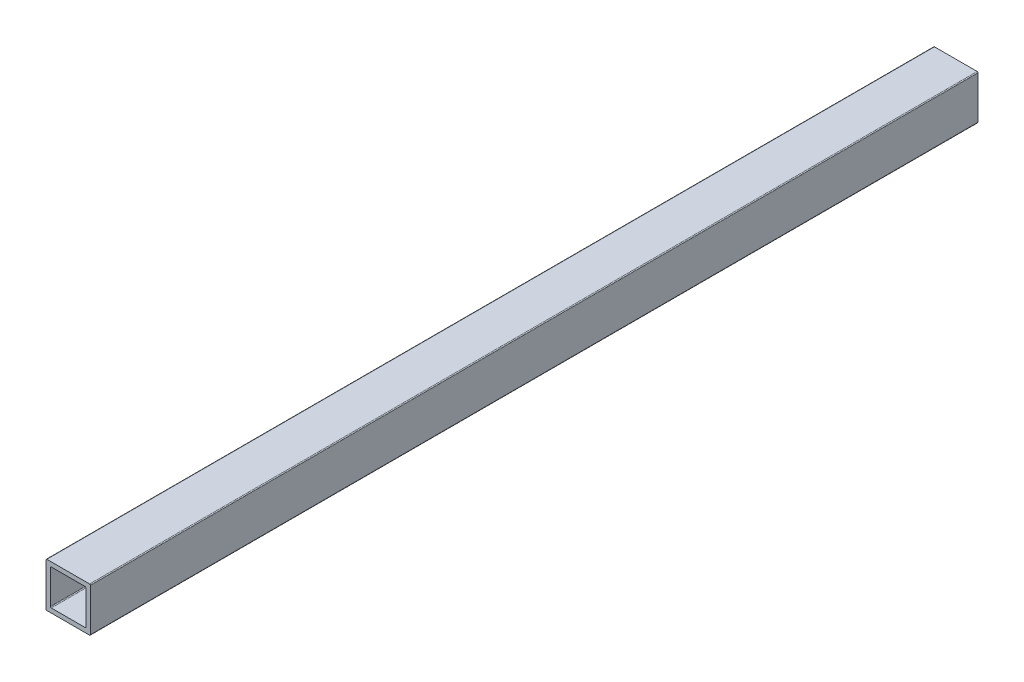
from build123d import *

# Parameters (mm, degrees)
SKETCH_1_W      = 10
SKETCH_1_H      = 10
SKETCH_1_W_2    = 8
SKETCH_1_H_2    = 8
EXTRUDE_1_DEPTH = 200
FILLET_1_R      = 0.2


with BuildPart() as part:
    # 草圖1 → 填料-伸長1 (new body)
    with BuildSketch(Plane.XY):
        Rectangle(SKETCH_1_W, SKETCH_1_H)
        Rectangle(SKETCH_1_W_2, SKETCH_1_H_2, mode=Mode.SUBTRACT)
    extrude(amount=EXTRUDE_1_DEPTH)

    # 圓角1
    fillet_1_edges = [part.edges().sort_by_distance(p)[0] for p in [
        (-4, 4, 100),
        (-4, -4, 100),
        (4, -4, 100),
        (4, 4, 100),
        (-5, 5, 100),
        (5, 5, 100),
        (5, -5, 100),
        (-5, -5, 100),
    ]]
    fillet(fillet_1_edges, radius=FILLET_1_R)


solid = part.part
